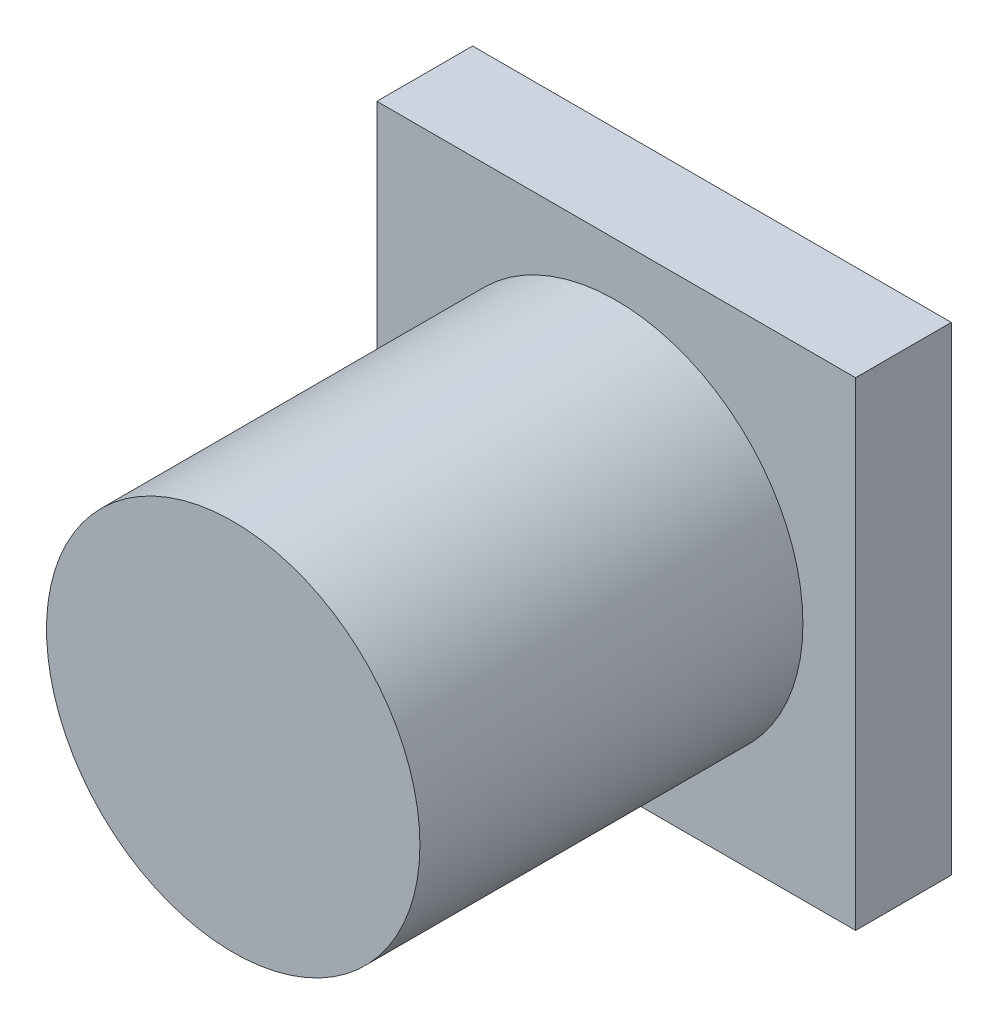
from build123d import *

# Parameters (mm, degrees)
CROQUIS1_W              = 10
CROQUIS1_H              = 10
SALIENTE_EXTRUIR1_DEPTH = 2
CROQUIS2_R              = 3.9
SALIENTE_EXTRUIR2_DEPTH = 8


with BuildPart() as part:
    # Croquis1 → Saliente-Extruir1 (new body)
    with BuildSketch(Plane.XY):
        Rectangle(CROQUIS1_W, CROQUIS1_H)
    extrude(amount=SALIENTE_EXTRUIR1_DEPTH)

    # Croquis2 → Saliente-Extruir2 (add)
    with BuildSketch(Plane.XY.offset(2)):
        Circle(CROQUIS2_R)
    extrude(amount=SALIENTE_EXTRUIR2_DEPTH)


solid = part.part
